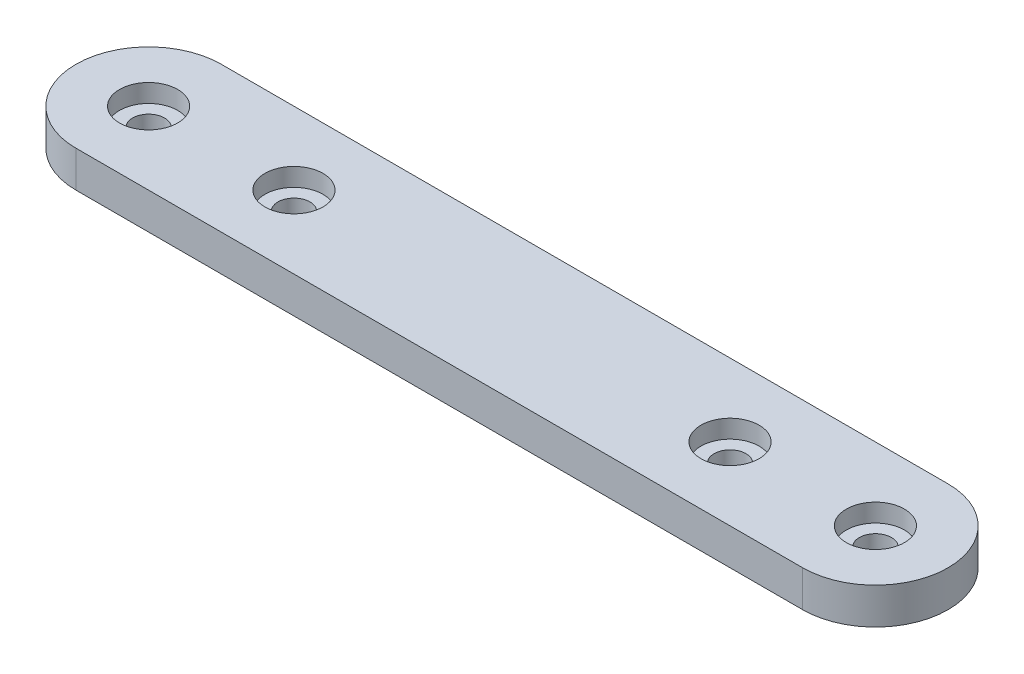
from build123d import *

# Parameters (mm, degrees)
SKETCH1_R           = 2.794
SKETCH1_R_2         = 2.813515076
BOSS_EXTRUDE1_DEPTH = 6.35
SKETCH3_R           = 2.794
CUT_EXTRUDE2_DEPTH  = 6.35
SKETCH2_R           = 5.08
CUT_EXTRUDE1_DEPTH  = 3.175


with BuildPart() as part:
    # Sketch1 → Boss-Extrude1 (new body)
    with BuildSketch(Plane(origin=(0, 0, 0), x_dir=(1, 0, 0), z_dir=(0, 1, 0))):
        with BuildLine():
            Line((0, 12.7), (127, 12.7))
            ThreePointArc((127, 12.7), (139.7, 0), (127, -12.7))
            Line((127, -12.7), (0, -12.7))
            ThreePointArc((0, -12.7), (-12.7, 0), (0, 12.7))
        make_face()
        with Locations(Location((0, 0, 0), (0, 0, 270))):
            Circle(SKETCH1_R, mode=Mode.SUBTRACT)
        with Locations(Location((127, 0, 0), (0, 0, 270))):
            Circle(SKETCH1_R_2, mode=Mode.SUBTRACT)
    extrude(amount=BOSS_EXTRUDE1_DEPTH)

    # Sketch3 → Cut-Extrude2 (cut)
    with BuildSketch(Plane(origin=(0, 6.35, 0), x_dir=(1, 0, 0), z_dir=(0, 1, 0))):
        with Locations(Location((25.4, 0, 0), (0, 0, 270))):
            Circle(SKETCH3_R)
        with Locations(Location((101.6, 0, 0), (0, 0, 270))):
            Circle(SKETCH3_R)
    extrude(amount=-CUT_EXTRUDE2_DEPTH, mode=Mode.SUBTRACT)

    # Sketch2 → Cut-Extrude1 (cut)
    with BuildSketch(Plane(origin=(0, 6.35, 0), x_dir=(1, 0, 0), z_dir=(0, 1, 0))):
        with Locations(Location((0, 0, 0), (0, 0, 270))):
            Circle(SKETCH2_R)
        with Locations(Location((127, 0, 0), (0, 0, 270))):
            Circle(SKETCH2_R)
        with Locations(Location((25.4, 0, 0), (0, 0, 270))):
            Circle(SKETCH2_R)
        with Locations(Location((101.6, 0, 0), (0, 0, 270))):
            Circle(SKETCH2_R)
    extrude(amount=-CUT_EXTRUDE1_DEPTH, mode=Mode.SUBTRACT)


solid = part.part
